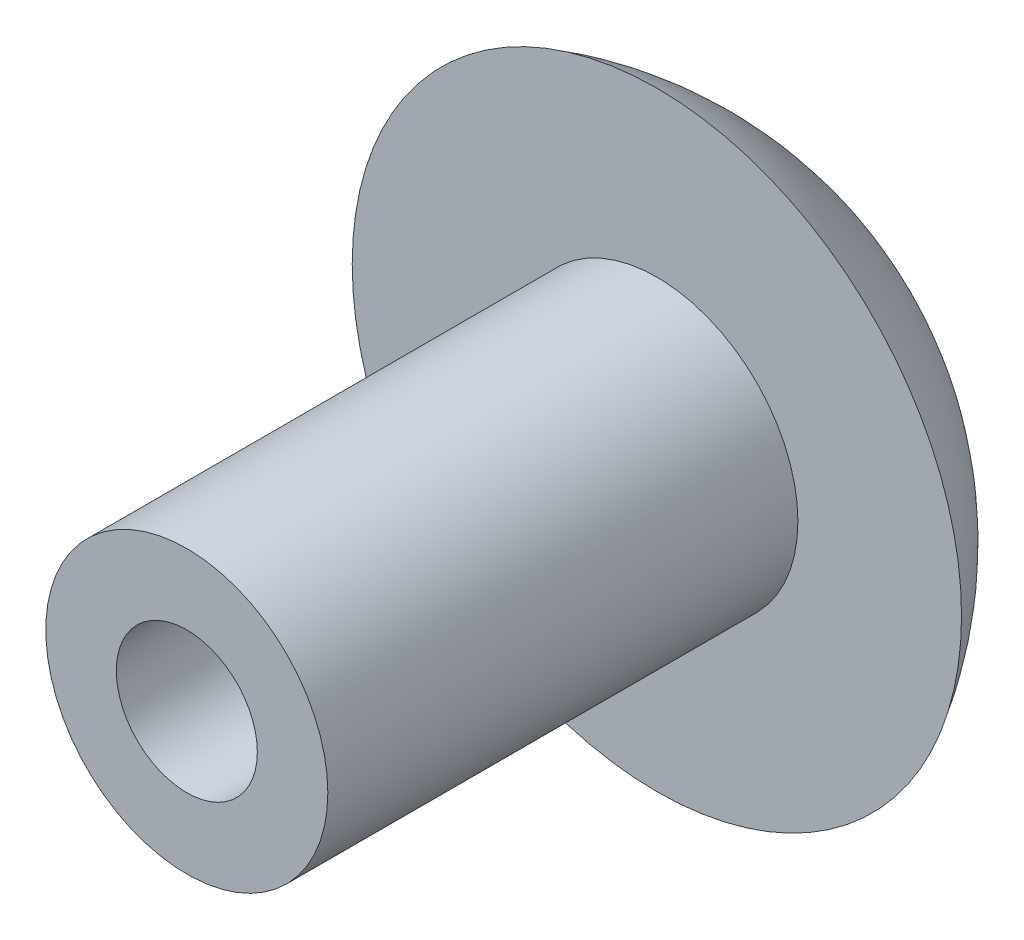
from build123d import *
from build123d.topology import SkipClean

# Parameters (mm, degrees)
CUT_EXTRUDE1_DEPTH      = 13.990381057
CUT_EXTRUDE1_DEPTH_BACK = 13.990381057
SKETCH2_W               = 18.087717894
SKETCH2_H               = 11.368107684
SKETCH3_R               = 3
BOSS_EXTRUDE1_DEPTH     = 10
SKETCH4_R               = 1.5
CUT_EXTRUDE2_DEPTH      = 10


with BuildPart() as part:
    # Sketch1 → Revolve1 (revolve)
    with BuildSketch(Plane(origin=(0, 0, 0), x_dir=(1, 0, 0), z_dir=(0, 1, 0))):
        with BuildLine():
            Line((-7.5, 0), (7.5, 0))
            ThreePointArc((7.5, 0), (0, 7.5), (-7.5, 0))
        make_face()
    revolve(axis=Axis((-65.403977461, 0, 0), (1, 0, 0)))

    # Sketch2 → Cut-Extrude1 (cut, two sides: drawn at the far end of the back side and taken through both)
    with SkipClean():  # the faces are left unmerged after this step: merging them gives an invalid solid
        with BuildSketch(Plane(origin=(0, 0, 0), x_dir=(1, 0, 0), z_dir=(0, 1, 0)).offset(-CUT_EXTRUDE1_DEPTH_BACK)):
            with Locations((0, -1.91002619)):
                Rectangle(SKETCH2_W, SKETCH2_H)
        extrude(amount=CUT_EXTRUDE1_DEPTH + CUT_EXTRUDE1_DEPTH_BACK, mode=Mode.SUBTRACT)

    # Sketch3 → Boss-Extrude1 (add)
    with SkipClean():  # the faces are left unmerged after this step: merging them gives an invalid solid
        with BuildSketch(Plane.XY.offset(-3.774027652)):
            Circle(SKETCH3_R)
        extrude(amount=BOSS_EXTRUDE1_DEPTH)

    # Sketch4 → Cut-Extrude2 (cut)
    with SkipClean():  # the faces are left unmerged after this step: merging them gives an invalid solid
        with BuildSketch(Plane.XY.offset(6.225972348)):
            Circle(SKETCH4_R)
        extrude(amount=-CUT_EXTRUDE2_DEPTH, mode=Mode.SUBTRACT)


solid = part.part
